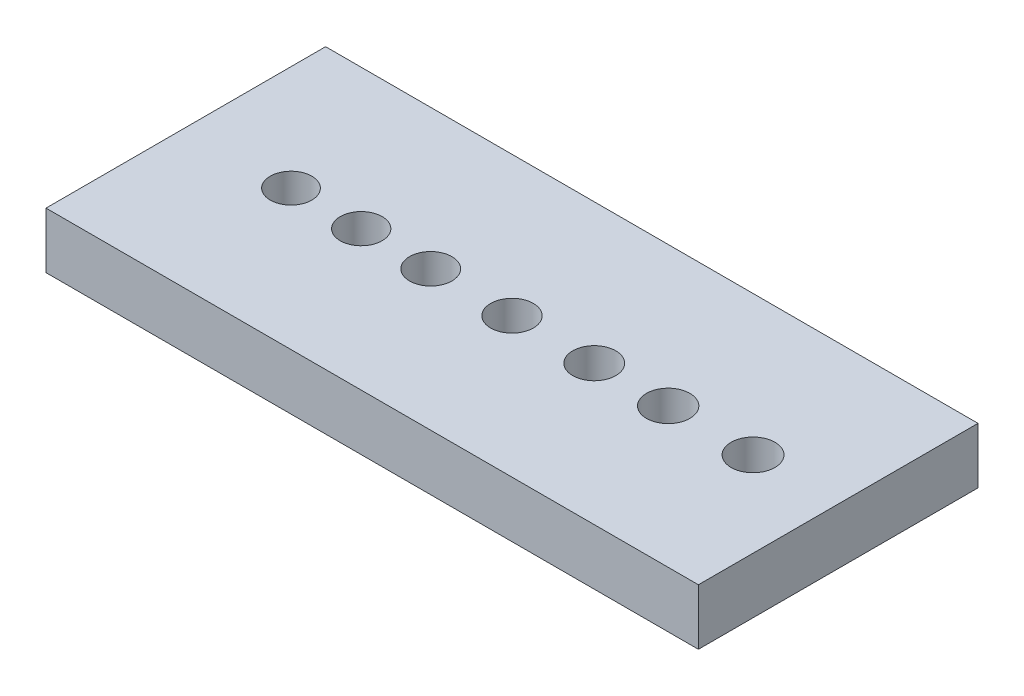
from build123d import *

# Parameters (mm, degrees)
CROQUIS1_W              = 35
CROQUIS1_H              = 15
CROQUIS1_R              = 1.115
CROQUIS1_R_2            = 1.125
CROQUIS1_R_3            = 1.135
CROQUIS1_R_4            = 1.145
CROQUIS1_R_5            = 1.155
CROQUIS1_R_6            = 1.165
CROQUIS1_R_7            = 1.175
SALIENTE_EXTRUIR1_DEPTH = 3


with BuildPart() as part:
    # Croquis1 → Saliente-Extruir1 (new body)
    with BuildSketch(Plane(origin=(0, 0, 0), x_dir=(1, 0, 0), z_dir=(0, 1, 0))):
        Rectangle(CROQUIS1_W, CROQUIS1_H)
        with Locations(Location((-11.854499795, 0, 0), (0, 0, 270))):
            Circle(CROQUIS1_R, mode=Mode.SUBTRACT)
        with Locations(Location((-8.089089959, 0, 0), (0, 0, 270))):
            Circle(CROQUIS1_R_2, mode=Mode.SUBTRACT)
        with Locations(Location((-4.3602375, 0, 0), (0, 0, 270))):
            Circle(CROQUIS1_R_3, mode=Mode.SUBTRACT)
        with Locations(Location((0, 0, 0), (0, 0, 270))):
            Circle(CROQUIS1_R_4, mode=Mode.SUBTRACT)
        with Locations(Location((4.413532992, 0, 0), (0, 0, 270))):
            Circle(CROQUIS1_R_5, mode=Mode.SUBTRACT)
        with Locations(Location((8.378550688, 0, 0), (0, 0, 270))):
            Circle(CROQUIS1_R_6, mode=Mode.SUBTRACT)
        with Locations(Location((12.931401845, 0, 0), (0, 0, 270))):
            Circle(CROQUIS1_R_7, mode=Mode.SUBTRACT)
    extrude(amount=SALIENTE_EXTRUIR1_DEPTH)


solid = part.part
